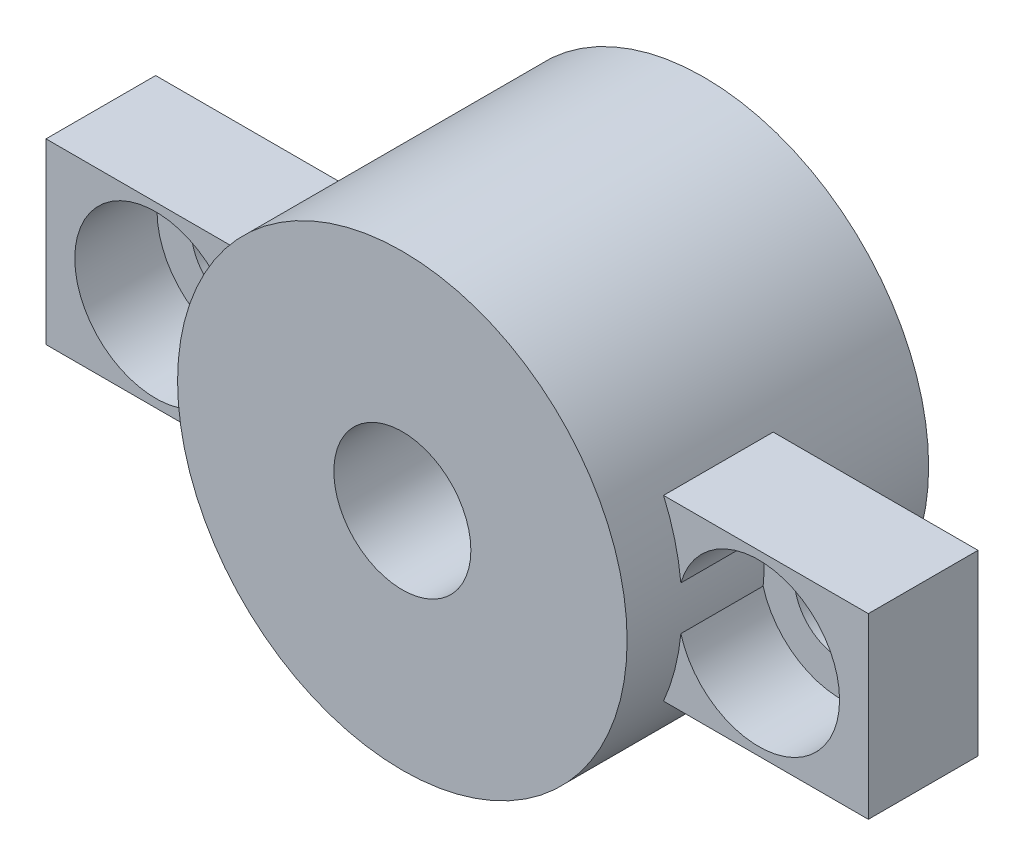
from build123d import *

# Parameters (mm, degrees)
CROQUIS1_R                   = 2.5
SALIENTE_EXTRUIR1_DEPTH      = 4
CROQUIS2_R                   = 1.7
CORTAR_EXTRUIR1_DEPTH        = 4
CROQUIS3_R                   = 2.95
CORTAR_EXTRUIR2_DEPTH        = 3
SALIENTE_EXTRUIR2_DEPTH      = 2
SALIENTE_EXTRUIR2_DEPTH_BACK = 9
CROQUIS4_R                   = 8.2
CROQUIS4_R_2                 = 2.5


with BuildPart() as part:
    # Croquis1 → Saliente-Extruir1 (new body)
    with BuildSketch(Plane.XY):
        with BuildLine():
            Line((-7.200520814, 3.25), (-15, 3.25))
            Line((-15, 3.25), (-15, -3.25))
            Line((-15, -3.25), (-7.200520814, -3.25))
            ThreePointArc((-7.200520814, -3.25), (0, -7.9), (7.200520814, -3.25))
            Line((7.200520814, -3.25), (15, -3.25))
            Line((15, -3.25), (15, 3.25))
            Line((15, 3.25), (7.200520814, 3.25))
            ThreePointArc((7.200520814, 3.25), (0, 7.9), (-7.200520814, 3.25))
        make_face()
        Circle(CROQUIS1_R, mode=Mode.SUBTRACT)
    extrude(amount=SALIENTE_EXTRUIR1_DEPTH)

    # Croquis2 → Cortar-Extruir1 (cut)
    with BuildSketch(Plane.XY.offset(4)):
        with Locations((-11, 0)):
            Circle(CROQUIS2_R)
        with Locations((11, 0)):
            Circle(CROQUIS2_R)
    extrude(amount=-CORTAR_EXTRUIR1_DEPTH, mode=Mode.SUBTRACT)

    # Croquis3 → Cortar-Extruir2 (cut)
    with BuildSketch(Plane.XY.offset(4)):
        with Locations((-11, 0)):
            Circle(CROQUIS3_R)
        with Locations((11, 0)):
            Circle(CROQUIS3_R)
    extrude(amount=-CORTAR_EXTRUIR2_DEPTH, mode=Mode.SUBTRACT)

    # Croquis4 → Saliente-Extruir2 (add, two sides: drawn at the far end of the back side and taken through both)
    with BuildSketch(Plane.XY.offset(4).offset(-SALIENTE_EXTRUIR2_DEPTH_BACK)):
        Circle(CROQUIS4_R)
        Circle(CROQUIS4_R_2, mode=Mode.SUBTRACT)
    extrude(amount=SALIENTE_EXTRUIR2_DEPTH + SALIENTE_EXTRUIR2_DEPTH_BACK)


solid = part.part
